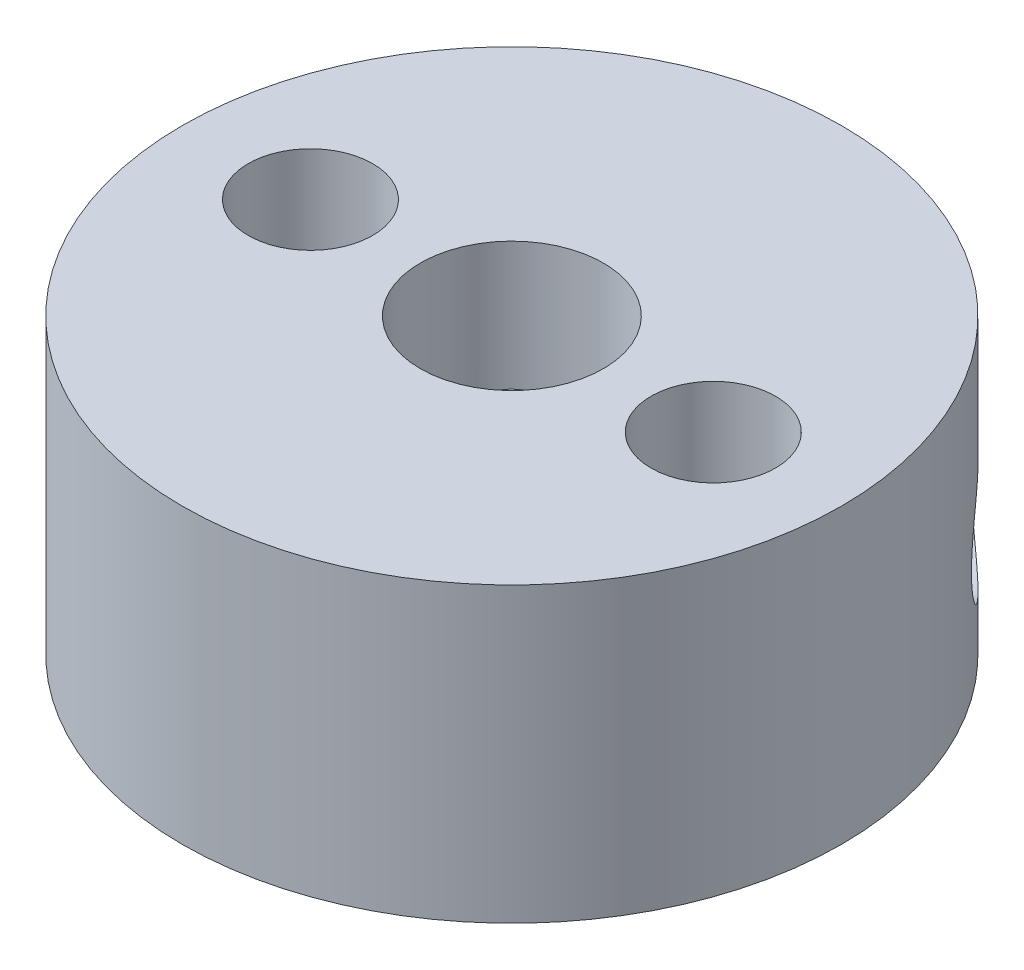
from build123d import *

# Parameters (mm, degrees)
SKETCH1_R           = 9
SKETCH1_R_2         = 2.5
SKETCH1_R_3         = 1.7
BOSS_EXTRUDE1_DEPTH = 8
SKETCH2_R           = 1.5
CUT_EXTRUDE1_DEPTH  = 16.033296378


with BuildPart() as part:
    # Sketch1 → Boss-Extrude1 (new body)
    with BuildSketch(Plane(origin=(0, 0, 0), x_dir=(1, 0, 0), z_dir=(0, 1, 0))):
        Circle(SKETCH1_R)
        Circle(SKETCH1_R_2, mode=Mode.SUBTRACT)
        with Locations((5.5, 0)):
            Circle(SKETCH1_R_3, mode=Mode.SUBTRACT)
        with Locations((-5.5, 0)):
            Circle(SKETCH1_R_3, mode=Mode.SUBTRACT)
    extrude(amount=BOSS_EXTRUDE1_DEPTH)

    # Sketch2 → Cut-Extrude1 (cut, through all)
    with BuildSketch(Plane(origin=(0, 0, 0), x_dir=(0, -1, 0), z_dir=(-0.7071067811865488, 0, 0.7071067811865464))):
        with Locations((-3, 0)):
            Circle(SKETCH2_R)
    cut_extrude1 = extrude(amount=-CUT_EXTRUDE1_DEPTH, mode=Mode.SUBTRACT)

    # Mirror1: Cut-Extrude1 across plane
    add(cut_extrude1.mirror(Plane(origin=(0, 0, 0), x_dir=(0, 0, 1), z_dir=(1, 0, 0))), mode=Mode.SUBTRACT)


solid = part.part
